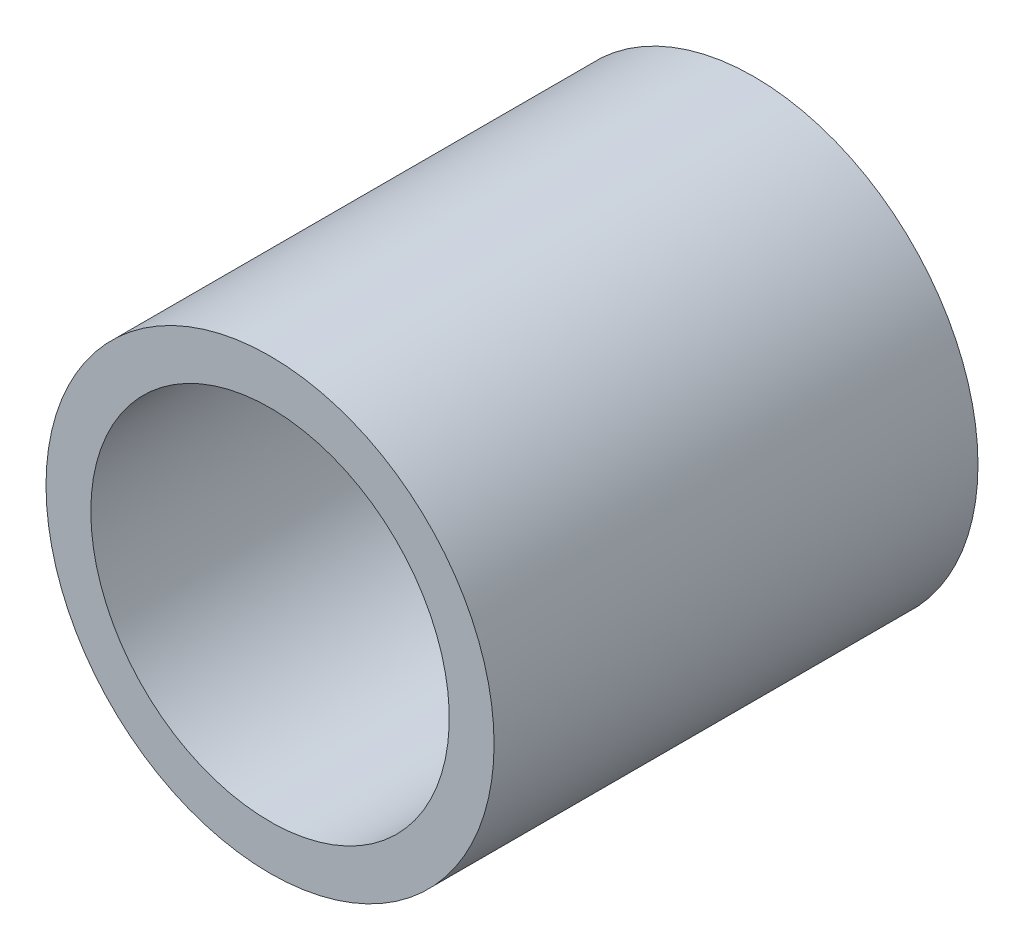
from build123d import *

# Parameters (mm, degrees)
SKETCH_1_R      = 5
SKETCH_1_R_2    = 4
EXTRUDE_1_DEPTH = 10.8


with BuildPart() as part:
    # ｽｹｯﾁ1 → ﾎﾞｽ - 押し出し1 (new body)
    with BuildSketch(Plane.XY):
        with Locations(Location((0, 0, 0), (0, 0, 180))):
            Circle(SKETCH_1_R)
        with Locations(Location((0, 0, 0), (0, 0, 180))):
            Circle(SKETCH_1_R_2, mode=Mode.SUBTRACT)
    extrude(amount=EXTRUDE_1_DEPTH)


solid = part.part
